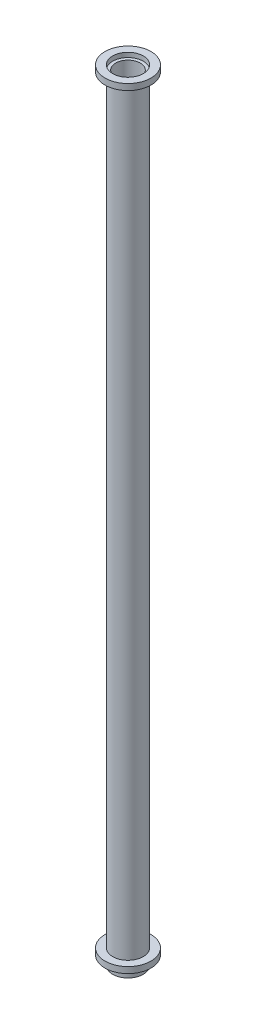
from build123d import *

# Parameters (mm, degrees)
SKETCH1_R           = 10
BOSS_EXTRUDE1_DEPTH = 506
SHELL1_T            = -2
BOSS_EXTRUDE2_START = -1
SKETCH2_R           = 15
SKETCH2_R_2         = 10
BOSS_EXTRUDE2_DEPTH = 4
LPATTERN1_COUNT     = 2
LPATTERN1_PITCH     = 499


with BuildPart() as part:
    # Sketch1 → Boss-Extrude1 (new body)
    with BuildSketch(Plane(origin=(0, 0, 0), x_dir=(1, 0, 0), z_dir=(0, 1, 0))):
        with Locations(Location((0, 0, 0), (0, 0, 270))):
            Circle(SKETCH1_R)
    extrude(amount=BOSS_EXTRUDE1_DEPTH)

    # Shell1
    shell1_openings = [part.faces().sort_by_distance(p)[0] for p in [
        (0, 506, 0),
        (0, 0, 0),
    ]]
    offset(amount=SHELL1_T, openings=shell1_openings, kind=Kind.INTERSECTION)

    # Sketch2 → Boss-Extrude2 (add)
    with BuildSketch(Plane(origin=(0, 506, 0), x_dir=(1, 0, 0), z_dir=(0, 1, 0)).offset(BOSS_EXTRUDE2_START)):
        with Locations(Location((0, 0, 0), (0, 0, 270))):
            Circle(SKETCH2_R)
        with Locations(Location((0, 0, 0), (0, 0, 270))):
            Circle(SKETCH2_R_2, mode=Mode.SUBTRACT)
    boss_extrude2 = extrude(amount=BOSS_EXTRUDE2_DEPTH)

    # LPattern1: Boss-Extrude2 ×2
    with Locations(*[(0, -i * LPATTERN1_PITCH, 0) for i in range(1, LPATTERN1_COUNT)]):
        add(boss_extrude2)


solid = part.part
